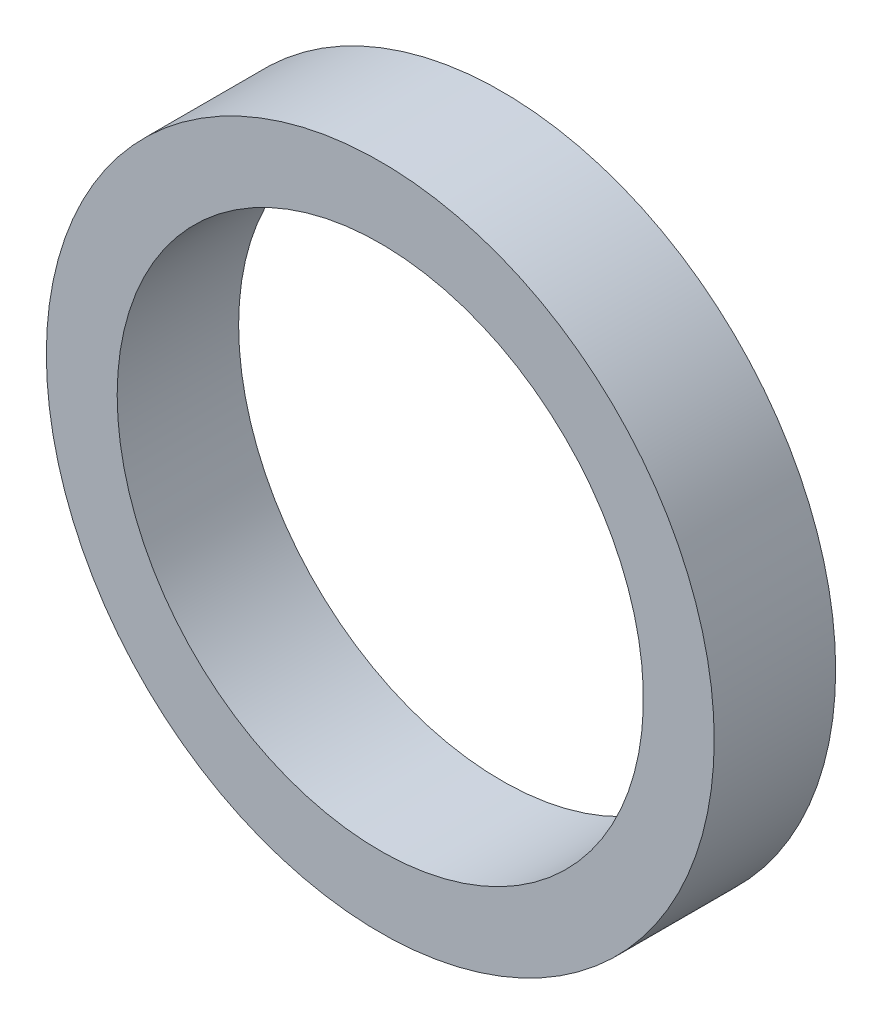
from build123d import *

# Parameters (mm, degrees)
SKETCH1_W = 17.5
SKETCH1_H = 30


with BuildPart() as part:
    # Sketch1 → Revolve2 (revolve)
    with BuildSketch(Plane(origin=(0, 0, 0), x_dir=(1, 0, 0), z_dir=(0, 1, 0))):
        with Locations((-73.75, 0)):
            Rectangle(SKETCH1_W, SKETCH1_H)
    revolve(axis=Axis((0, 0, -72.619565217), (0, 0, 1)))


solid = part.part
